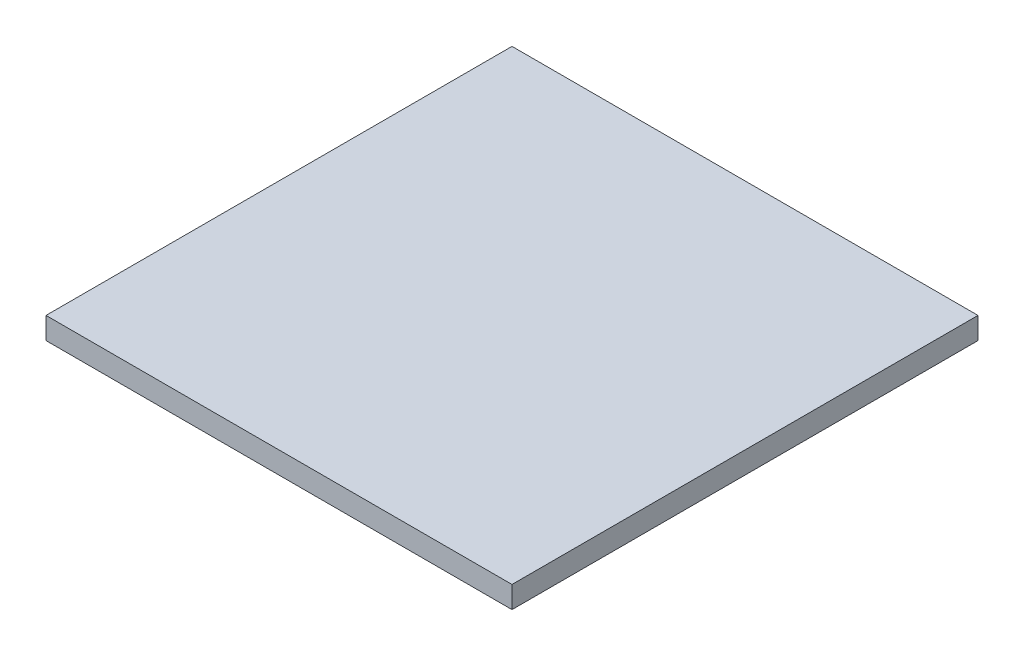
from build123d import *

# Parameters (mm, degrees)
SKETCH1_W           = 298.45
SKETCH1_H           = 298.45
BOSS_EXTRUDE1_DEPTH = 13.97


with BuildPart() as part:
    # Sketch1 → Boss-Extrude1 (new body)
    with BuildSketch(Plane(origin=(0, 0, 0), x_dir=(1, 0, 0), z_dir=(0, 1, 0))):
        Rectangle(SKETCH1_W, SKETCH1_H)
    extrude(amount=BOSS_EXTRUDE1_DEPTH)


solid = part.part
